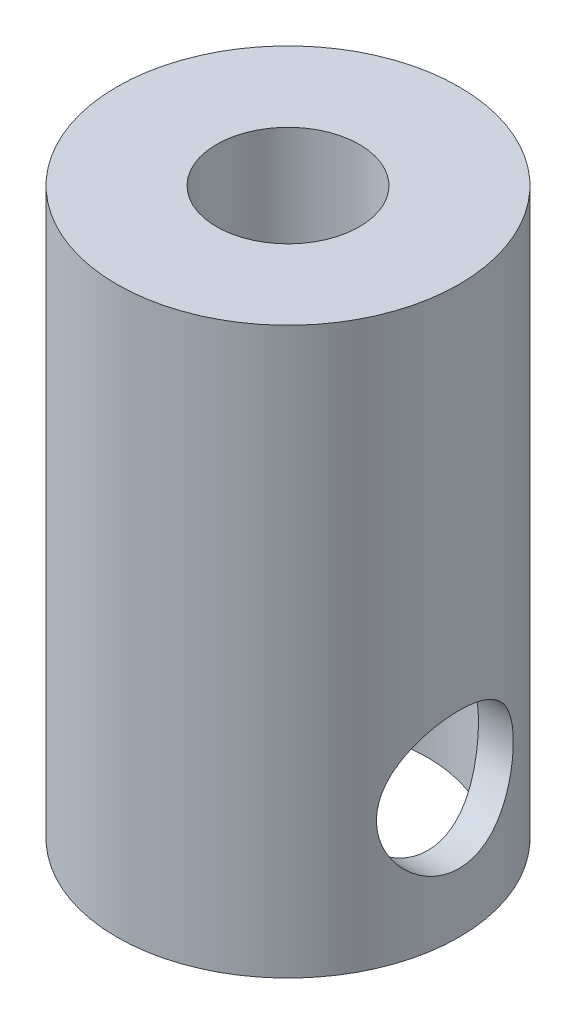
from build123d import *

# Parameters (mm, degrees)
SKETCH1_R               = 5.75
SKETCH1_R_2             = 4.7
BOSS_EXTRUDE1_DEPTH     = 10
CUT_EXTRUDE1_DEPTH      = 13.888948755
CUT_EXTRUDE1_DEPTH_BACK = 13.888948755
SKETCH2_R               = 2.3
SKETCH3_R               = 5.75
BOSS_EXTRUDE2_DEPTH     = 9
BOSS_EXTRUDE3_START     = 0.5
SKETCH4_R               = 4.7
BOSS_EXTRUDE3_DEPTH     = 0.5
CUT_EXTRUDE2_DEPTH      = 21.667002833
CUT_EXTRUDE2_DEPTH_BACK = 4.5
SKETCH5_R               = 2.4


with BuildPart() as part:
    # Sketch1 → Boss-Extrude1 (new body)
    with BuildSketch(Plane(origin=(0, 0, 0), x_dir=(1, 0, 0), z_dir=(0, 1, 0))):
        with Locations(Location((0, 0, 0), (0, 0, 270))):
            Circle(SKETCH1_R)
        with Locations(Location((0, 0, 0), (0, 0, 270))):
            Circle(SKETCH1_R_2, mode=Mode.SUBTRACT)
    extrude(amount=BOSS_EXTRUDE1_DEPTH)

    # Sketch2 → Cut-Extrude1 (cut, two sides: drawn at the far end of the back side and taken through both)
    with BuildSketch(Plane(origin=(0, 0, 0), x_dir=(0, 0, -1), z_dir=(1, 0, 0)).offset(-CUT_EXTRUDE1_DEPTH_BACK)):
        with Locations((0, 4.3)):
            Circle(SKETCH2_R)
    extrude(amount=CUT_EXTRUDE1_DEPTH + CUT_EXTRUDE1_DEPTH_BACK, mode=Mode.SUBTRACT)

    # Sketch3 → Boss-Extrude2 (add)
    with BuildSketch(Plane(origin=(0, 10, 0), x_dir=(1, 0, 0), z_dir=(0, 1, 0))):
        with Locations(Location((0, 0, 0), (0, 0, 270))):
            Circle(SKETCH3_R)
    extrude(amount=BOSS_EXTRUDE2_DEPTH)

    # Sketch4 → Boss-Extrude3 (add)
    with BuildSketch(Plane.XZ.offset(-10).offset(BOSS_EXTRUDE3_START)):
        with Locations(Location((0, 0, 0), (0, 0, 270))):
            Circle(SKETCH4_R)
    extrude(amount=-BOSS_EXTRUDE3_DEPTH)

    # Sketch5 → Cut-Extrude2 (cut, two sides: drawn at the far end of the back side and taken through both)
    with BuildSketch(Plane(origin=(0, 19, 0), x_dir=(1, 0, 0), z_dir=(0, 1, 0)).offset(-CUT_EXTRUDE2_DEPTH_BACK)):
        with Locations(Location((0, 0, 0), (0, 0, 90))):
            Circle(SKETCH5_R)
    extrude(amount=CUT_EXTRUDE2_DEPTH + CUT_EXTRUDE2_DEPTH_BACK, mode=Mode.SUBTRACT)


solid = part.part
